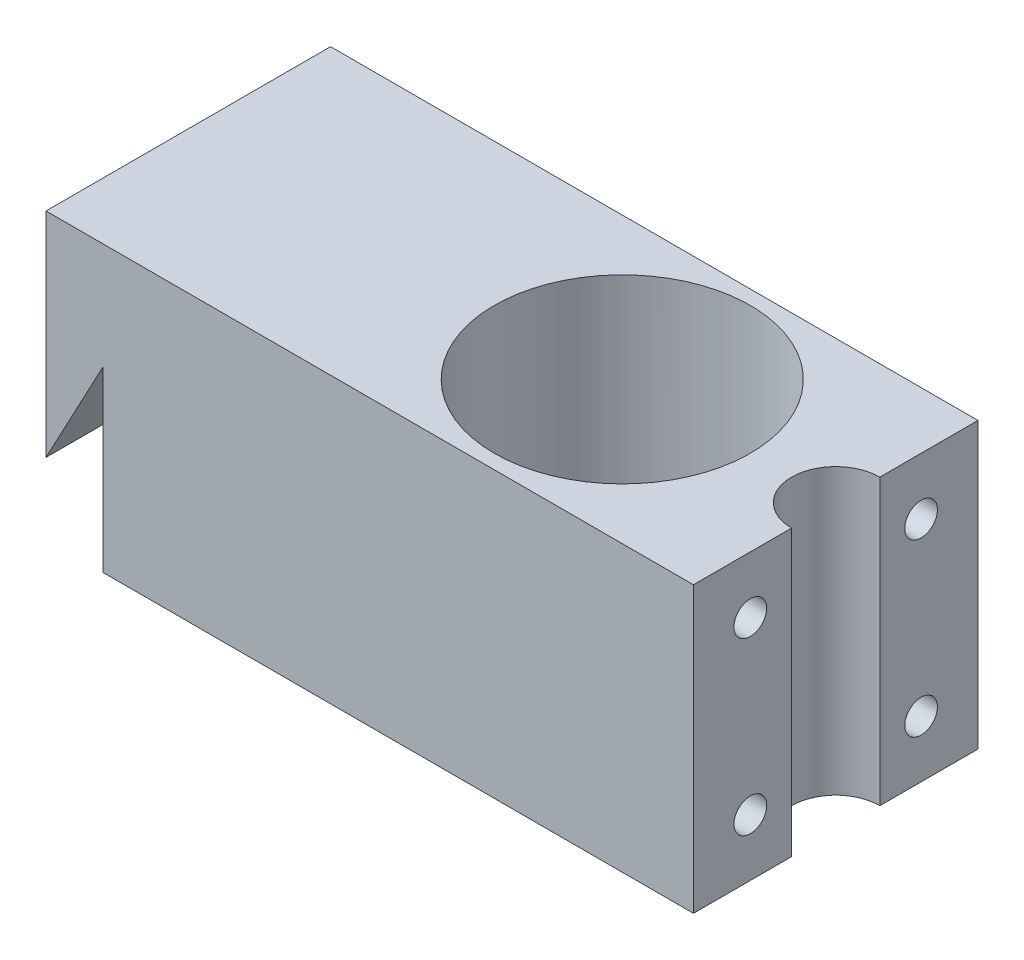
from build123d import *

# Parameters (mm, degrees)
BOSS_EXTRUDE1_DEPTH = 10
CUT_EXTRUDE1_REACH  = 35.915
SKETCH3_R           = 9
SKETCH3_R_2         = 3.1
SKETCH4_R           = 1.15
CUT_EXTRUDE2_DEPTH  = 10


with BuildPart() as part:
    # Sketch2 → Boss-Extrude1 (new, symmetric)
    with BuildSketch(Plane.XY):
        Polygon((-16, -10), (25.5, -10), (25.5, 10), (-20, 10), (-20, -5), (-16, 2.5), align=None)
    extrude(amount=BOSS_EXTRUDE1_DEPTH, both=True)

    # Sketch3 → Cut-Extrude1 (cut, up to next)
    with BuildSketch(Plane(origin=(0, 10, 0), x_dir=(1, 0, 0), z_dir=(0, 1, 0)), mode=Mode.PRIVATE) as cut_extrude1_sk1:
        with Locations(Location((10.5, 0, 0), (0, 0, 270))):
            Circle(SKETCH3_R)
    cut_extrude1_tool1 = extrude(cut_extrude1_sk1.sketch, amount=-CUT_EXTRUDE1_REACH, mode=Mode.PRIVATE) & part.part
    # Sketch3 → Cut-Extrude1 (cut, up to next)
    with BuildSketch(Plane(origin=(0, 10, 0), x_dir=(1, 0, 0), z_dir=(0, 1, 0)), mode=Mode.PRIVATE) as cut_extrude1_sk2:
        with Locations((25.5, 0)):
            Circle(SKETCH3_R_2)
    cut_extrude1_tool2 = extrude(cut_extrude1_sk2.sketch, amount=-CUT_EXTRUDE1_REACH, mode=Mode.PRIVATE) & part.part
    add(cut_extrude1_tool1.solids().sort_by_distance((10.5, 10, 0))[0], mode=Mode.SUBTRACT)
    add(cut_extrude1_tool2.solids().sort_by_distance((25.5, 10, 0))[0], mode=Mode.SUBTRACT)

    # Sketch4 → Cut-Extrude2 (cut)
    with BuildSketch(Plane(origin=(25.5, 0, 0), x_dir=(0, 0, -1), z_dir=(1, 0, 0))):
        with Locations((-6, 6)):
            Circle(SKETCH4_R)
        with Locations((-6, -6)):
            Circle(SKETCH4_R)
        with Locations((6, -6)):
            Circle(SKETCH4_R)
        with Locations((6, 6)):
            Circle(SKETCH4_R)
    extrude(amount=-CUT_EXTRUDE2_DEPTH, mode=Mode.SUBTRACT)


solid = part.part
